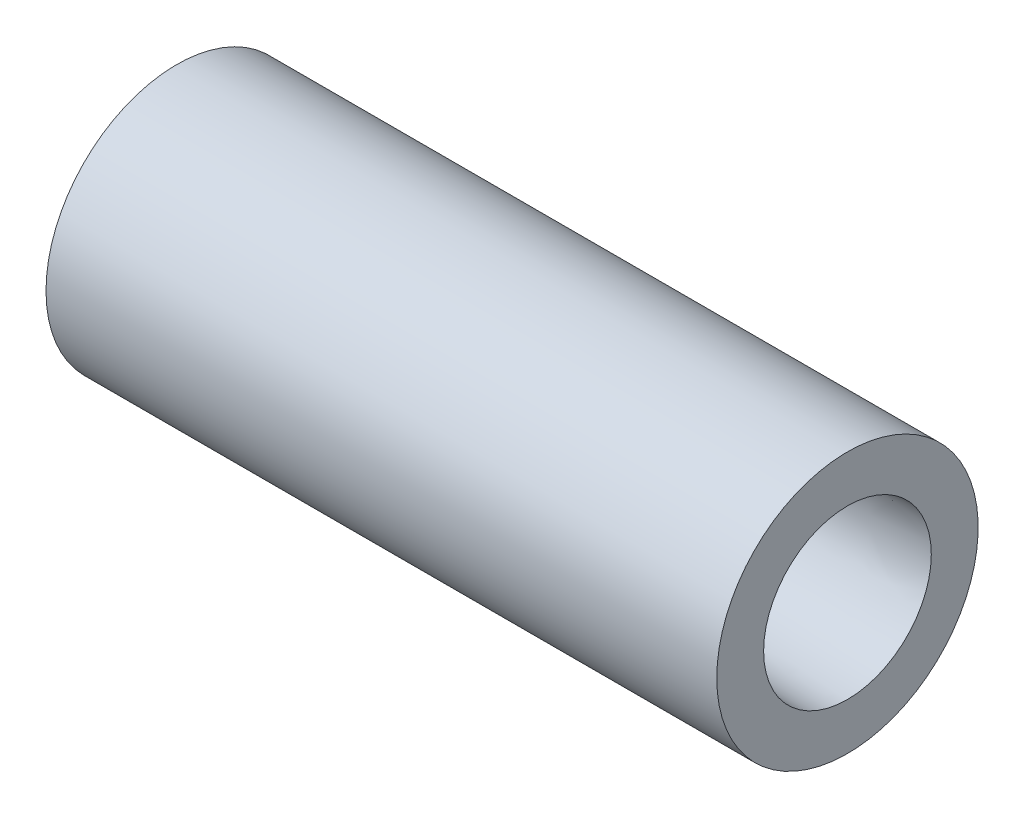
from build123d import *


with BuildPart() as part:
    # Çizim1 → Döndür1 (revolve)
    with BuildSketch(Plane.XY, mode=Mode.PRIVATE) as d_nd_r1_sk:
        with BuildLine():
            Line((0, 3.579194929), (0, 5.579194929))
            Line((0, 5.579194929), (28.633559429, 5.579194929))
            Line((28.633559429, 5.579194929), (28.633559429, 3.579194929))
            add(Edge.make_bspline(
                [(28.633559429, 3.579194929), (27.288838094, 3.548816487), (25.94574747, 3.488391293), (24.748521533, 3.434528502), (23.260655716, 3.339684727), (22.168090491, 3.270039326), (20.577168186, 3.160049078), (18.972661187, 3.049119636), (17.895974643, 2.952835816)],
                knots=[0, 0, 0, 0.25, 0.25, 0.5, 0.5, 0.75, 0.75, 1, 1, 1], degree=2))
            add(Edge.make_bspline(
                [(17.895974643, 2.952835816), (17.016914527, 2.874224946), (16.105027852, 2.777807374), (15.209638282, 2.68313411), (14.314000801, 2.590835616), (13.279719039, 2.484249356), (12.523454468, 2.415618194), (11.872051374, 2.356503232), (11.629830944, 2.328808469), (11.12877327, 2.271519025), (10.737584786, 2.192256894)],
                knots=[0, 0, 0, 0.25, 0.25, 0.5, 0.5, 0.75, 0.75, 0.875, 0.875, 1, 1, 1], degree=2))
            add(Edge.make_bspline(
                [(10.737584786, 2.192256894), (10.714074676, 2.187493304), (10.512578349, 2.144841622), (10.375927725, 2.115916137), (10.287749162, 2.100239226), (10.029922524, 2.054401271), (9.838984818, 2.058105153), (9.641656407, 2.061933004), (9.392069372, 2.118364338), (9.323124419, 2.13395271), (9.243676092, 2.154758174), (9.172398085, 2.173424042), (8.947987317, 2.236996832)],
                knots=[0, 0, 0, 0.125, 0.125, 0.25, 0.25, 0.5, 0.5, 0.75, 0.75, 0.833333333, 0.833333333, 1, 1, 1], degree=2))
            add(Edge.make_bspline(
                [(8.947987317, 2.236996832), (8.611069002, 2.332441616), (8.277782612, 2.419397953), (7.944213186, 2.506428137), (7.610689869, 2.593634853), (7.038993583, 2.743116922), (6.273401544, 2.950182282), (5.296586681, 3.214375888), (4.936190954, 3.306956399), (4.523411411, 3.412993564), (4.261226163, 3.46829567), (3.888947479, 3.546819522), (3.579194929, 3.579194929)],
                knots=[0, 0, 0, 0.125, 0.125, 0.25, 0.25, 0.5, 0.5, 0.75, 0.75, 0.875, 0.875, 1, 1, 1], degree=2))
            add(Edge.make_bspline(
                [(3.579194929, 3.579194929), (3.198899414, 3.618943502), (2.68688793, 3.610100237), (2.462280286, 3.6062209), (2.238325099, 3.596581704), (2.013998548, 3.586926525), (1.789597465, 3.579194929), (0.89245554, 3.548284476), (0, 3.579194929)],
                knots=[0, 0, 0, 0.25, 0.25, 0.375, 0.375, 0.5, 0.5, 1, 1, 1], degree=2))
        make_face()
    revolve(d_nd_r1_sk.sketch.rotate(Axis((0, 0, 0), (1, 0, 0)), 90), axis=Axis((0, 0, 0), (1, 0, 0)))


solid = part.part
